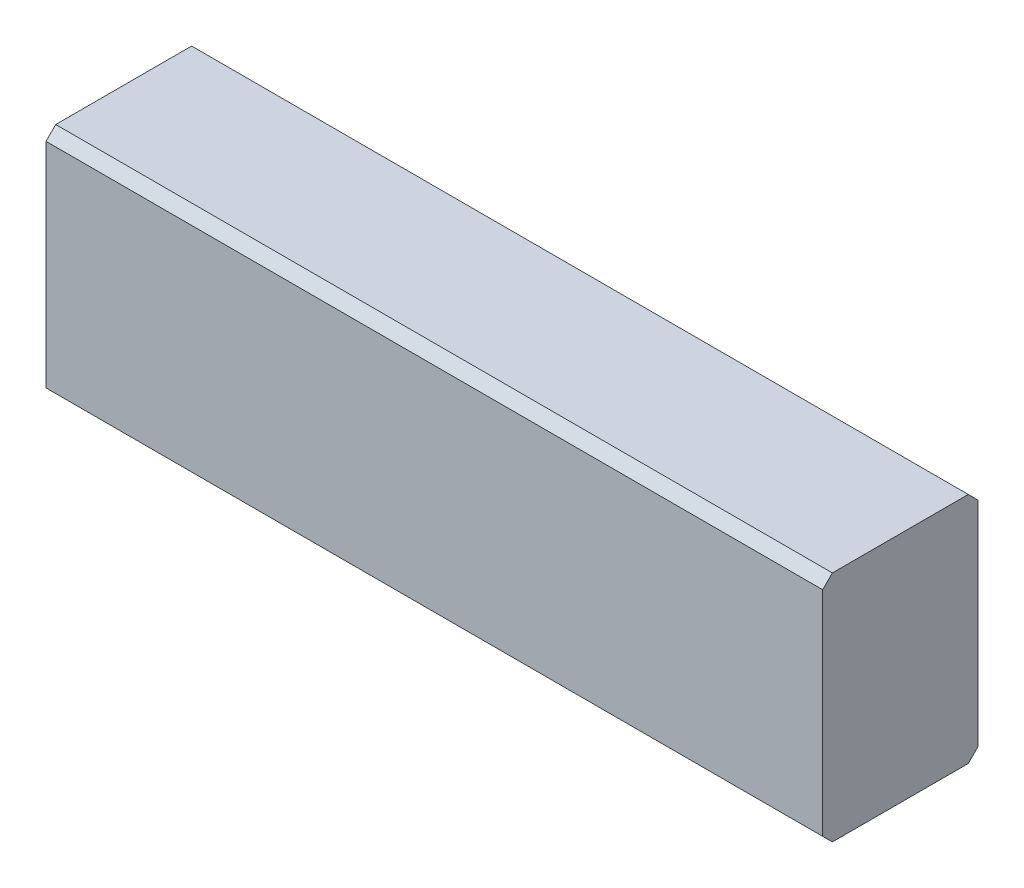
from build123d import *

# Parameters (mm, degrees)
EXTRUDE1_DEPTH = 4
SKETCH2_W      = 20
SKETCH2_H      = 6
EXTRUDE2_DEPTH = 4
CHAMFER1_SIZE  = 0.25


with BuildPart() as part:
    # Sketch1 → Extrude1 (new body)
    with BuildSketch(Plane.XY):
        with BuildLine():
            Line((0, 3), (-14, 3))
            ThreePointArc((-14, 3), (-17, 0), (-14, -3))
            Line((-14, -3), (0, -3))
            ThreePointArc((0, -3), (3, 0), (0, 3))
        make_face()
    extrude(amount=EXTRUDE1_DEPTH)

    # Sketch2 → Extrude2 (add)
    with BuildSketch(Plane.XY):
        with Locations((-7, 0)):
            Rectangle(SKETCH2_W, SKETCH2_H)
    extrude(amount=EXTRUDE2_DEPTH)

    # Chamfer1
    chamfer1_edges = [part.edges().sort_by_distance(p)[0] for p in [
        (-7, -3, 4),
        (-7, -3, 0),
        (-7, 3, 0),
        (-7, 3, 4),
    ]]
    chamfer(chamfer1_edges, length=CHAMFER1_SIZE)


solid = part.part
